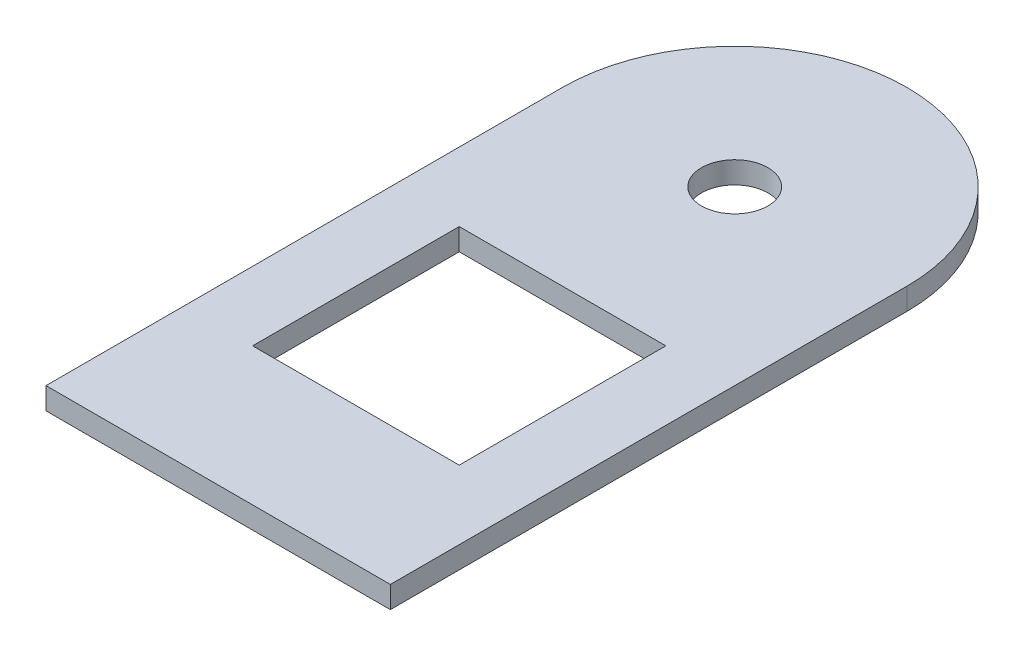
from build123d import *

# Parameters (mm, degrees)
SKETCH1_R           = 4.82
SKETCH1_W           = 30
SKETCH1_H           = 30
BOSS_EXTRUDE1_DEPTH = 3.175


with BuildPart() as part:
    # Sketch1 → Boss-Extrude1 (new body)
    with BuildSketch(Plane(origin=(0, 0, 0), x_dir=(1, 0, 0), z_dir=(0, 1, 0))):
        with BuildLine():
            ThreePointArc((50, -25), (25, 0), (0, -25))
            Line((0, -25), (0, -100))
            Line((0, -100), (50, -100))
            Line((50, -100), (50, -25))
        make_face()
        with Locations(Location((25, -25, 0), (0, 0, 270))):
            Circle(SKETCH1_R, mode=Mode.SUBTRACT)
        with Locations((25, -65)):
            Rectangle(SKETCH1_W, SKETCH1_H, mode=Mode.SUBTRACT)
    extrude(amount=BOSS_EXTRUDE1_DEPTH)


solid = part.part
